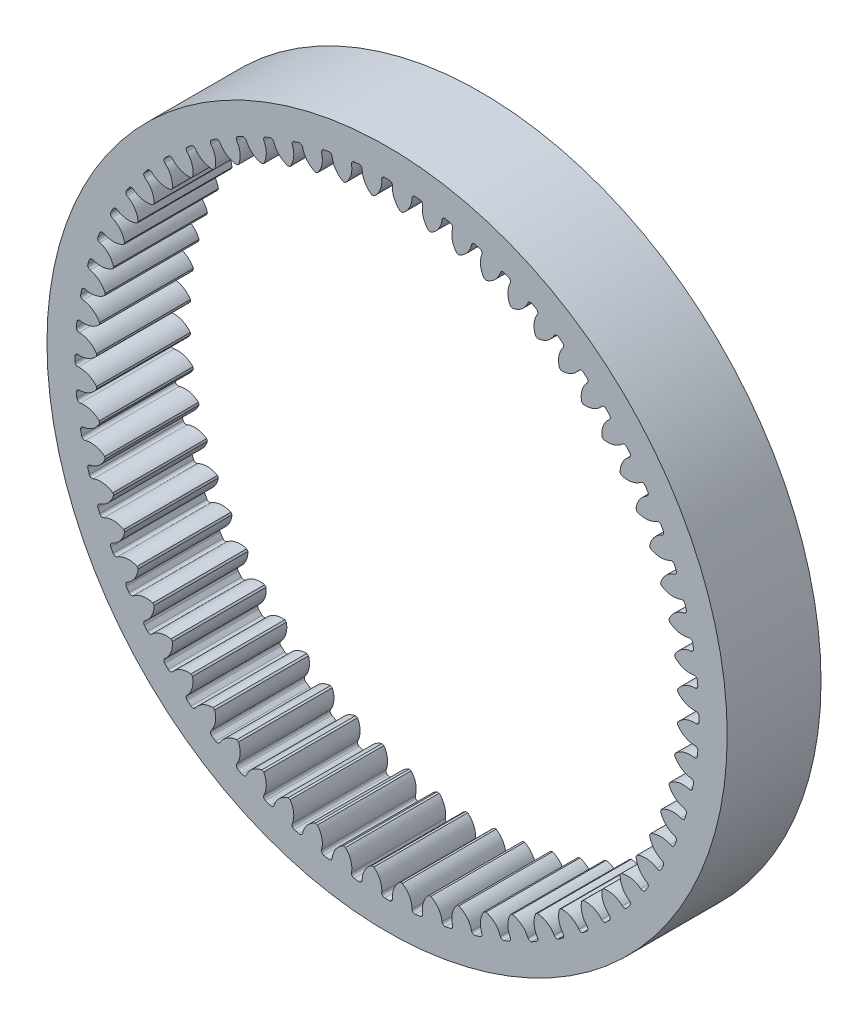
from build123d import *

# Parameters (mm, degrees)
SKETCH1_R                    = 72.5
SKETCH1_R_2                  = 62
RING_PROFILE_DEPTH           = 10
TEETH_PROFILE_DEPTH          = 105.462912079
TEETH_CIRCULAR_PATTERN_COUNT = 64


with BuildPart() as part:
    # Sketch1 → Ring Profile (new, symmetric)
    with BuildSketch(Plane.XY):
        Circle(SKETCH1_R)
        Circle(SKETCH1_R_2, mode=Mode.SUBTRACT)
    extrude(amount=RING_PROFILE_DEPTH, both=True)

    # Sketch2 → Teeth Profile (cut, through all)
    with BuildSketch(Plane.XY.offset(10)):
        with BuildLine():
            Line((0.519039789, 66.5), (-0.519039789, 66.5))
            ThreePointArc((-0.519039789, 66.5), (-0.978781836, 66.29839373), (-1.141925869, 65.823639201))
            ThreePointArc((-1.141925869, 65.823639201), (-1.495419113, 63.669893131), (-2.82075, 61.935800386))
            ThreePointArc((-2.82075, 61.935800386), (0, 62), (2.82075, 61.935800386))
            ThreePointArc((2.82075, 61.935800386), (1.495419113, 63.669893131), (1.141925869, 65.823639201))
            ThreePointArc((1.141925869, 65.823639201), (0.978781836, 66.29839373), (0.519039789, 66.5))
        make_face()
    teeth_profile = extrude(amount=-TEETH_PROFILE_DEPTH, mode=Mode.SUBTRACT)

    # Teeth Circular Pattern: Teeth Profile ×64 about axis
    teeth_circular_pattern_axis = Axis((0, 0, 0), (0, 0, 1))
    for i in range(1, TEETH_CIRCULAR_PATTERN_COUNT):
        add(teeth_profile.rotate(teeth_circular_pattern_axis, i * 360 / TEETH_CIRCULAR_PATTERN_COUNT), mode=Mode.SUBTRACT)


solid = part.part
